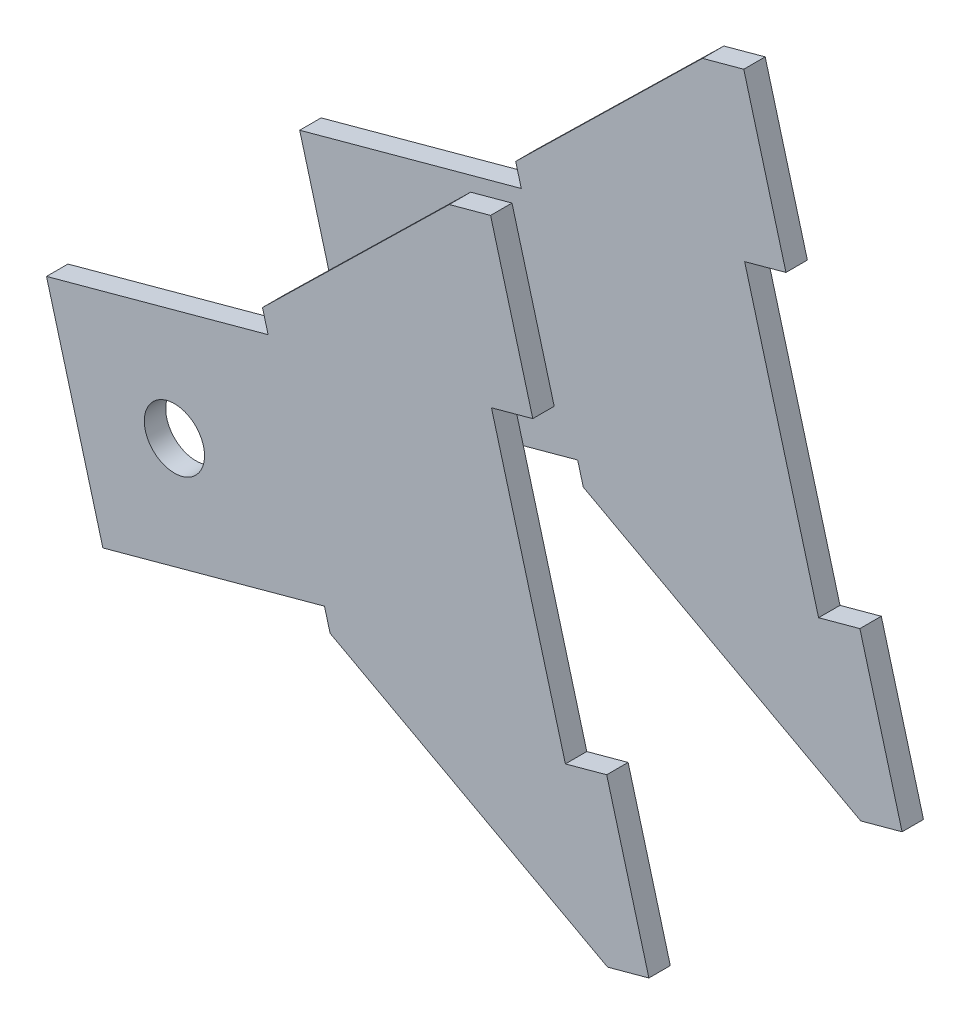
from build123d import *

# Parameters (mm, degrees)
BOSS_EXTRUDE1_START = -90
SKETCH1_R           = 14.2875
BOSS_EXTRUDE1_DEPTH = 10.16
BOSS_EXTRUDE2_START = -210.16
SKETCH1_2_R         = 14.2875
BOSS_EXTRUDE2_DEPTH = 10.16


with BuildPart() as part:
    # Sketch1 → Boss-Extrude1 (new body)
    with BuildSketch(Plane(origin=(2328.589821282, 466.462033654, -4.0040129), x_dir=(0.9648587645409115, 0.26276903259057416, 0), z_dir=(0, 0, 1)).offset(BOSS_EXTRUDE1_START)):
        Polygon((-2161.218921834, 236.892663878), (-2270.218921834, 236.892663878), (-2270.218921834, 135.08549762), (-2161.218921834, 135.08549762), (-2161.218921834, 124.92549762), (-2052.911580455, 21.456991118), (-2032.591580455, 21.456991118), (-2032.591580455, 97.656991118), (-2052.911580455, 97.656991118), (-2052.911580455, 231.177276923), (-2032.591580455, 231.177276923), (-2032.591580455, 307.377276923), (-2052.911580455, 307.377276923), (-2161.218921834, 247.052663878), align=None)
        with Locations((-2221.165130355, 185.989080749)):
            Circle(SKETCH1_R, mode=Mode.SUBTRACT)
    extrude(amount=BOSS_EXTRUDE1_DEPTH)


with BuildPart() as body_2:
    # Sketch1<2> → Boss-Extrude2 (new body)
    with BuildSketch(Plane(origin=(2328.589821282, 466.462033654, -4.0040129), x_dir=(0.9648587645409115, 0.26276903259057416, 0), z_dir=(0, 0, 1)).offset(BOSS_EXTRUDE2_START)):
        Polygon((-2161.218921834, 236.892663878), (-2270.218921834, 236.892663878), (-2270.218921834, 135.08549762), (-2161.218921834, 135.08549762), (-2161.218921834, 124.92549762), (-2052.911580455, 21.456991118), (-2032.591580455, 21.456991118), (-2032.591580455, 97.656991118), (-2052.911580455, 97.656991118), (-2052.911580455, 231.177276923), (-2032.591580455, 231.177276923), (-2032.591580455, 307.377276923), (-2052.911580455, 307.377276923), (-2161.218921834, 247.052663878), align=None)
        with Locations((-2221.165130355, 185.989080749)):
            Circle(SKETCH1_2_R, mode=Mode.SUBTRACT)
    extrude(amount=BOSS_EXTRUDE2_DEPTH)


solid = Compound([part.part, body_2.part])
